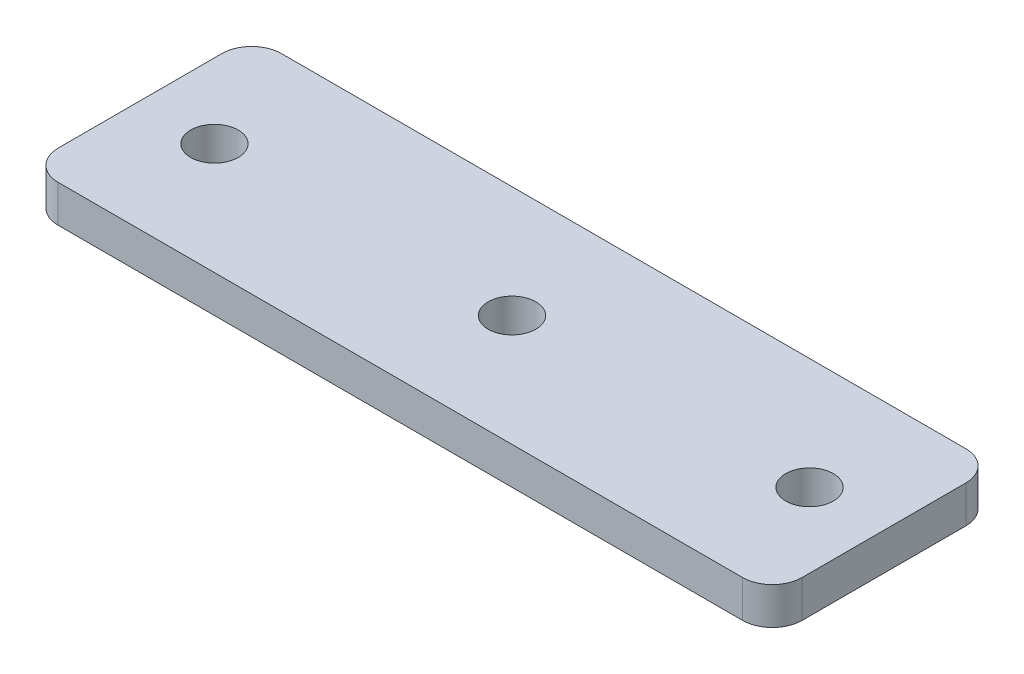
from build123d import *

# Parameters (mm, degrees)
SKETCH_1_W          = 50
SKETCH_1_H          = 15
EXTRUDE_1_DEPTH     = 2.5
SKETCH_2_R          = 1.6
CUT_EXTRUDE_1_DEPTH = 27.220221204
FILLET_1_R          = 2


with BuildPart() as part:
    # 草图1 → 凸台-拉伸1 (new body)
    with BuildSketch(Plane(origin=(0, 0, 0), x_dir=(1, 0, 0), z_dir=(0, 1, 0))):
        Rectangle(SKETCH_1_W, SKETCH_1_H)
    extrude(amount=EXTRUDE_1_DEPTH)

    # 草图2 → 切除-拉伸1 (cut, through all)
    with BuildSketch(Plane(origin=(0, 2.5, 0), x_dir=(1, 0, 0), z_dir=(0, 1, 0))):
        with Locations(Location((0, 0, 0), (0, 0, 270))):
            Circle(SKETCH_2_R)
        with Locations(Location((-20, 0, 0), (0, 0, 270))):
            Circle(SKETCH_2_R)
        with Locations(Location((20, 0, 0), (0, 0, 270))):
            Circle(SKETCH_2_R)
    extrude(amount=-CUT_EXTRUDE_1_DEPTH, mode=Mode.SUBTRACT)

    # 圆角1
    fillet_1_edges = [part.edges().sort_by_distance(p)[0] for p in [
        (25, 1.25, 7.5),
        (-25, 1.25, 7.5),
        (-25, 1.25, -7.5),
        (25, 1.25, -7.5),
    ]]
    fillet(fillet_1_edges, radius=FILLET_1_R)


solid = part.part
